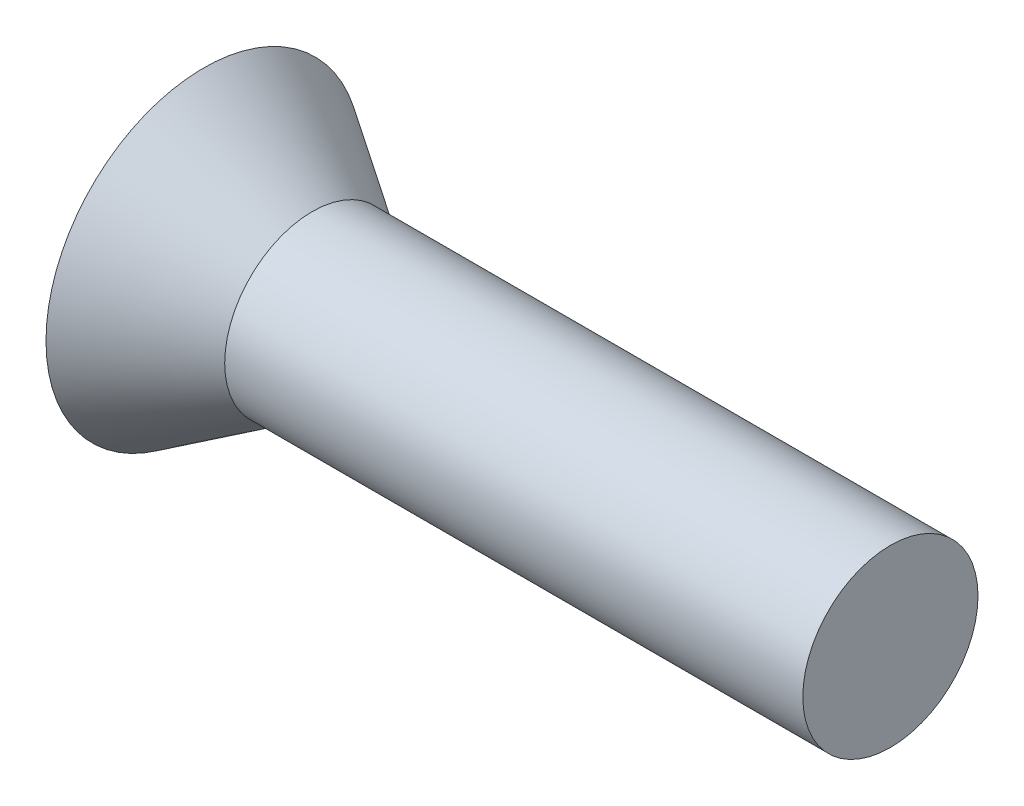
from build123d import *

# Parameters (mm, degrees)
SKETCH_2_W          = 1
SKETCH_2_H          = 1.75
SKETCH_2_W_2        = 1.75
SKETCH_2_H_2        = 1
CUT_EXTRUDE_1_DEPTH = 2


with BuildPart() as part:
    # Эскиз1 → Повернуть1 (revolve)
    with BuildSketch(Plane.XY, mode=Mode.PRIVATE) as revolve_1_sk:
        Polygon((-19.6, 0), (-19.6, 4.5), (-16.5, 2.5), (0, 2.5), (0, 0), align=None)
    revolve(revolve_1_sk.sketch.rotate(Axis((-51.630571285, 0, 0), (1, 0, 0)), 90), axis=Axis((-51.630571285, 0, 0), (1, 0, 0)))

    # Эскиз2 → Вырез-Вытянуть1 (cut)
    with BuildSketch(Plane.ZY.offset(19.6)):
        with Locations((0, 1.375)):
            Rectangle(SKETCH_2_W, SKETCH_2_H)
        with Locations((1.375, 0)):
            Rectangle(SKETCH_2_W_2, SKETCH_2_H_2)
        with Locations((0, -1.375)):
            Rectangle(SKETCH_2_W, SKETCH_2_H)
        with Locations((-1.375, 0)):
            Rectangle(SKETCH_2_W_2, SKETCH_2_H_2)
        Rectangle(SKETCH_2_W, SKETCH_2_H_2)
    extrude(amount=-CUT_EXTRUDE_1_DEPTH, mode=Mode.SUBTRACT)


solid = part.part
